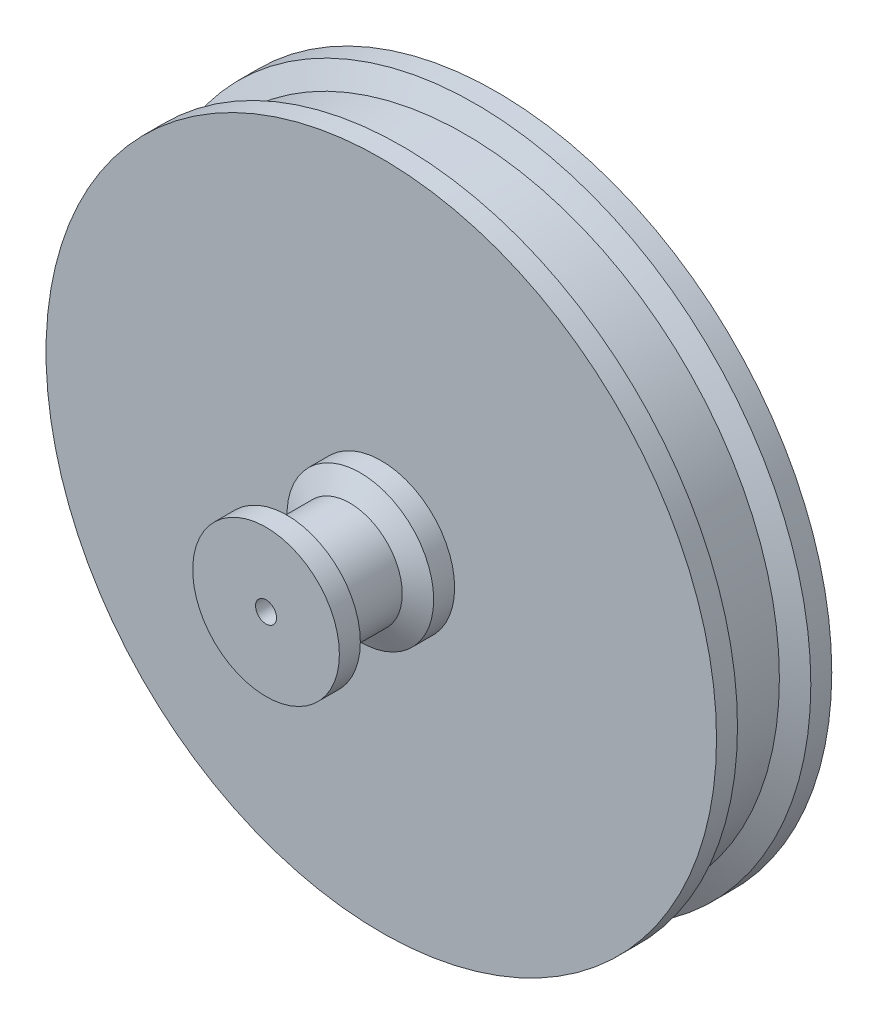
from build123d import *

# Parameters (mm, degrees)
SKETCH1_R           = 32
SKETCH1_R_2         = 1
BOSS_EXTRUDE1_DEPTH = 11
SKETCH7_R           = 7
SKETCH7_R_2         = 1
BOSS_EXTRUDE3_DEPTH = 11


with BuildPart() as part:
    # Sketch1 → Boss-Extrude1 (new body)
    with BuildSketch(Plane.XY):
        Circle(SKETCH1_R)
        Circle(SKETCH1_R_2, mode=Mode.SUBTRACT)
    extrude(amount=BOSS_EXTRUDE1_DEPTH)

    # Sketch4 → Cut-Revolve1 (revolve, cut)
    with BuildSketch(Plane(origin=(0, 0, 0), x_dir=(0, 0, -1), z_dir=(1, 0, 0)), mode=Mode.PRIVATE) as cut_revolve1_sk:
        Polygon((-2, 32), (-3, 30), (-8, 30), (-9, 32), align=None)
    revolve(cut_revolve1_sk.sketch.rotate(Axis((0, 0, 1000), (0, 0, -1)), 90), axis=Axis((0, 0, 1000), (0, 0, -1)), mode=Mode.SUBTRACT)

    # Sketch7 → Boss-Extrude3 (add)
    with BuildSketch(Plane.XY.offset(11)):
        Circle(SKETCH7_R)
        Circle(SKETCH7_R_2, mode=Mode.SUBTRACT)
    extrude(amount=BOSS_EXTRUDE3_DEPTH)

    # Sketch8 → Cut-Revolve3 (revolve, cut)
    with BuildSketch(Plane(origin=(0, 0, 0), x_dir=(0, 0, -1), z_dir=(1, 0, 0)), mode=Mode.PRIVATE) as cut_revolve3_sk:
        Polygon((-20, 7), (-13, 7), (-14, 5), (-19, 5), align=None)
    revolve(cut_revolve3_sk.sketch.rotate(Axis((0, 0, 1000), (0, 0, -1)), 90), axis=Axis((0, 0, 1000), (0, 0, -1)), mode=Mode.SUBTRACT)


solid = part.part
